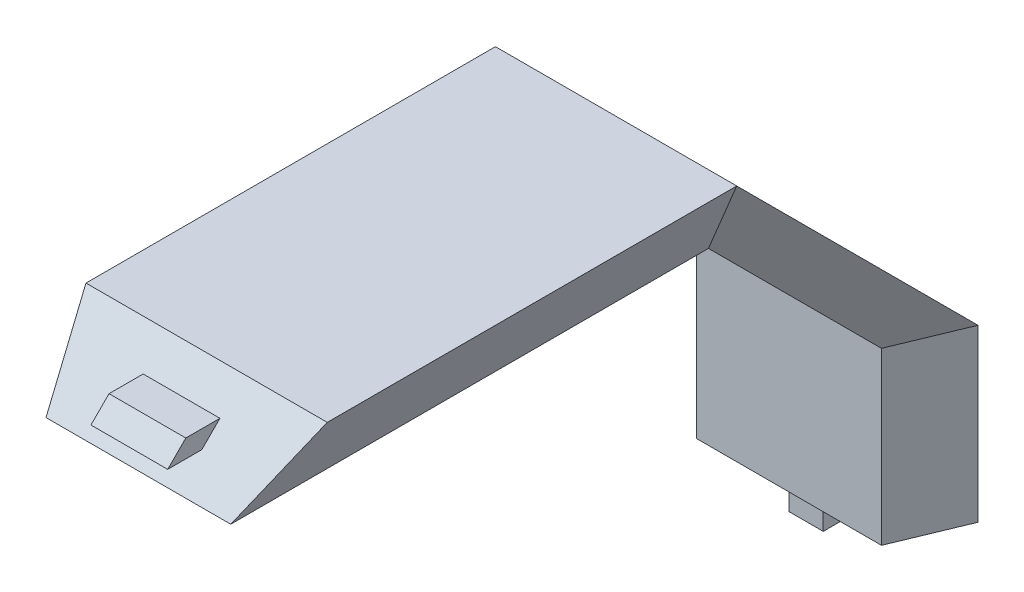
from build123d import *

# Parameters (mm, degrees)
BOSS_EXTRUDE1_DEPTH     = 10
BOSS_EXTRUDE5_DEPTH     = 20
CUT_EXTRUDE1_DEPTH      = 43.284970512
CUT_EXTRUDE1_DEPTH_BACK = 43.284970512
BOSS_EXTRUDE7_DEPTH     = 28
CUT_EXTRUDE3_DEPTH      = 52.790286451
CUT_EXTRUDE3_DEPTH_BACK = 52.790286451
SKETCH31_W              = 4.5
SKETCH31_H              = 1.5
BOSS_EXTRUDE8_DEPTH     = 2
SKETCH32_W              = 2
SKETCH32_H              = 2
BOSS_EXTRUDE9_DEPTH     = 2


with BuildPart() as part:
    # Sketch2 → Boss-Extrude1 (new body)
    with BuildSketch(Plane(origin=(0, 0, 0), x_dir=(1, 0, 0), z_dir=(0, 1, 0))):
        Polygon((30.067911316, 5.900626551), (31.724765565, 1.900626551), (42.55319269, 1.900626551), (44.21004694, 5.900626551), align=None)
    extrude(amount=BOSS_EXTRUDE1_DEPTH)

    # Sketch9 → Boss-Extrude5 (add, along a direction that is not the sketch's normal)
    with BuildSketch(Plane(origin=(0, 10, 0), x_dir=(1, 0, 0), z_dir=(0, 1, 0))):
        Polygon((30.067911316, 5.900626551), (31.724765565, 1.900626551), (42.55319269, 1.900626551), (44.21004694, 5.900626551), align=None)
    extrude(amount=BOSS_EXTRUDE5_DEPTH, dir=(1.7578001538897393e-15, 0.7071067811865437, 0.7071067811865515))

    # Sketch14 → Cut-Extrude1 (cut, two sides: drawn at the far end of the back side and taken through both)
    with BuildSketch(Plane(origin=(37.138979128, -13.011121517, 13.011121517), x_dir=(-2.5975542964999143e-15, -0.11094714299783787, -0.9938263084969211), z_dir=(1, 0, 0)).offset(-CUT_EXTRUDE1_DEPTH_BACK)):
        Polygon((0.618118596, 37.453059267), (-3.357186638, 37.009270695), (1.061907168, 33.477754033), align=None)
    extrude(amount=CUT_EXTRUDE1_DEPTH + CUT_EXTRUDE1_DEPTH_BACK, mode=Mode.SUBTRACT)

    # Sketch15 → Boss-Extrude7 (add)
    with BuildSketch(Plane.XY.offset(8.241509073)):
        Polygon((30.067911316, 24.142135624), (31.724765565, 20.142135624), (42.55319269, 20.142135624), (44.21004694, 24.142135624), align=None)
    extrude(amount=BOSS_EXTRUDE7_DEPTH)

    # Sketch30 → Cut-Extrude3 (cut, two sides: drawn at the far end of the back side and taken through both)
    with BuildSketch(Plane(origin=(37.138979128, -12.611751667, 0.445063165), x_dir=(-2.6136735802757005e-15, -0.0035891178684094257, -0.9999935590957207), z_dir=(1, 0, 0)).offset(-CUT_EXTRUDE3_DEPTH_BACK)):
        Polygon((-35.928129381, 36.625172899), (-35.913772909, 32.625198662), (-31.928155144, 36.63952937), align=None)
    extrude(amount=CUT_EXTRUDE3_DEPTH + CUT_EXTRUDE3_DEPTH_BACK, mode=Mode.SUBTRACT)

    # Sketch31 → Boss-Extrude8 (add, along a direction that is not the sketch's normal)
    with BuildSketch(Plane(origin=(0, 28.191822348, 28.191822348), x_dir=(1, 0, 0), z_dir=(0, 0.7071067811865434, 0.7071067811865517))):
        with Locations((37.138979128, -8.555549014)):
            Rectangle(SKETCH31_W, SKETCH31_H)
    extrude(amount=BOSS_EXTRUDE8_DEPTH, dir=(0, 0, 1))

    # Sketch32 → Boss-Extrude9 (add)
    with BuildSketch(Plane.XZ):
        with Locations((37.138979128, -3.900626551)):
            Rectangle(SKETCH32_W, SKETCH32_H)
    extrude(amount=BOSS_EXTRUDE9_DEPTH)


solid = part.part
